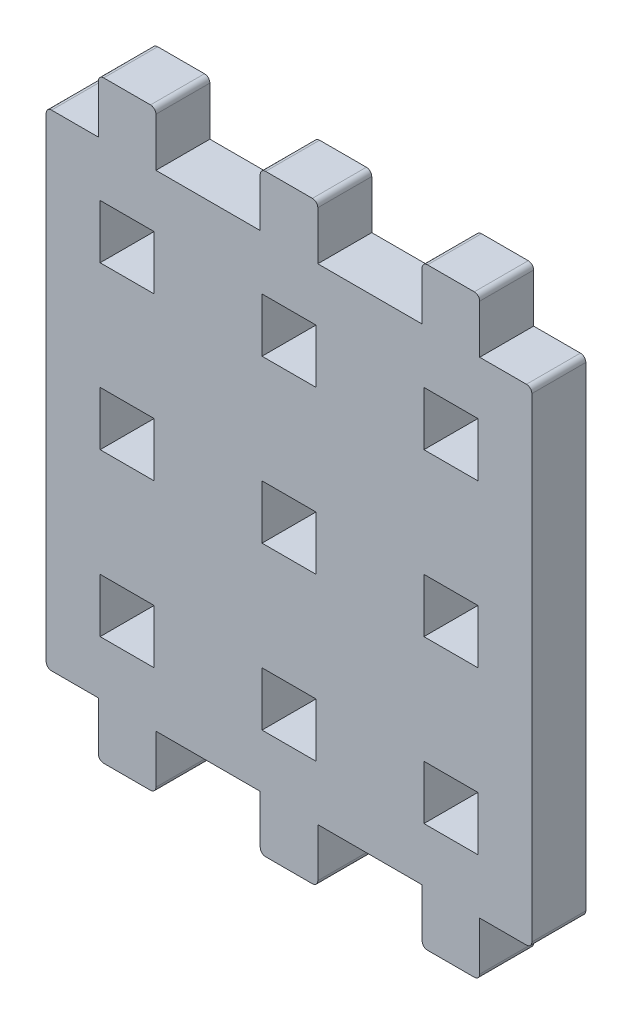
from build123d import *

# Parameters (mm, degrees)
MODEL_W                 = 3
MODEL_H                 = 3
MODEL_W_2               = 3.000000001
SALIENTE_EXTRUIR1_DEPTH = 3


with BuildPart() as part:
    # Model → Saliente-Extruir1 (new body)
    with BuildSketch(Plane.XY):
        with BuildLine():
            Line((8.96548528, 297.776664772), (8.96548528, 271.376664772))
            ThreePointArc((8.96548528, 271.376664772), (9.053353246, 271.164532738), (9.265485281, 271.076664772))
            Line((9.265485281, 271.076664772), (11.86548528, 271.076664772))
            Line((11.86548528, 271.076664772), (11.86548528, 268.376664772))
            ThreePointArc((11.86548528, 268.376664772), (11.953353246, 268.164532738), (12.165485281, 268.076664772))
            Line((12.165485281, 268.076664772), (14.765485281, 268.076664772))
            ThreePointArc((14.765485281, 268.076664772), (14.977617315, 268.164532738), (15.065485281, 268.376664772))
            Line((15.065485281, 268.376664772), (15.065485281, 271.076664772))
            Line((15.065485281, 271.076664772), (20.86548528, 271.076664772))
            Line((20.86548528, 271.076664772), (20.86548528, 268.376664772))
            ThreePointArc((20.86548528, 268.376664772), (20.953353246, 268.164532738), (21.165485281, 268.076664772))
            Line((21.165485281, 268.076664772), (23.76548528, 268.076664772))
            ThreePointArc((23.76548528, 268.076664772), (23.977617315, 268.164532738), (24.06548528, 268.376664772))
            Line((24.06548528, 268.376664772), (24.06548528, 271.076664772))
            Line((24.06548528, 271.076664772), (29.86548528, 271.076664772))
            Line((29.86548528, 271.076664772), (29.86548528, 268.376664772))
            ThreePointArc((29.86548528, 268.376664772), (29.953353246, 268.164532738), (30.165485281, 268.076664772))
            Line((30.165485281, 268.076664772), (32.765485281, 268.076664772))
            ThreePointArc((32.765485281, 268.076664772), (32.977617315, 268.164532738), (33.06548528, 268.376664772))
            Line((33.06548528, 268.376664772), (33.06548528, 271.076664772))
            Line((33.06548528, 271.076664772), (35.66548528, 271.076664772))
            ThreePointArc((35.66548528, 271.076664772), (35.877617315, 271.164532738), (35.96548528, 271.376664772))
            Line((35.96548528, 271.376664772), (35.96548528, 297.776664772))
            ThreePointArc((35.96548528, 297.776664772), (35.877617315, 297.988796806), (35.66548528, 298.076664772))
            Line((35.66548528, 298.076664772), (33.06548528, 298.076664772))
            Line((33.06548528, 298.076664772), (33.06548528, 300.776664772))
            ThreePointArc((33.06548528, 300.776664772), (32.977617315, 300.988796806), (32.765485281, 301.076664772))
            Line((32.765485281, 301.076664772), (30.165485281, 301.076664772))
            ThreePointArc((30.165485281, 301.076664772), (29.953353246, 300.988796806), (29.86548528, 300.776664772))
            Line((29.86548528, 300.776664772), (29.86548528, 298.076664772))
            Line((29.86548528, 298.076664772), (24.06548528, 298.076664772))
            Line((24.06548528, 298.076664772), (24.06548528, 300.776664772))
            ThreePointArc((24.06548528, 300.776664772), (23.977617315, 300.988796806), (23.76548528, 301.076664772))
            Line((23.76548528, 301.076664772), (21.165485281, 301.076664772))
            ThreePointArc((21.165485281, 301.076664772), (20.953353246, 300.988796806), (20.86548528, 300.776664772))
            Line((20.86548528, 300.776664772), (20.86548528, 298.076664772))
            Line((20.86548528, 298.076664772), (15.065485281, 298.076664772))
            Line((15.065485281, 298.076664772), (15.065485281, 300.776664772))
            ThreePointArc((15.065485281, 300.776664772), (14.977617315, 300.988796806), (14.765485281, 301.076664772))
            Line((14.765485281, 301.076664772), (12.165485281, 301.076664772))
            ThreePointArc((12.165485281, 301.076664772), (11.953353246, 300.988796806), (11.86548528, 300.776664772))
            Line((11.86548528, 300.776664772), (11.86548528, 298.076664772))
            Line((11.86548528, 298.076664772), (9.265485281, 298.076664772))
            ThreePointArc((9.265485281, 298.076664772), (9.053353246, 297.988796806), (8.96548528, 297.776664772))
        make_face()
        with Locations((13.46548528, 293.576664772)):
            Rectangle(MODEL_W, MODEL_H, mode=Mode.SUBTRACT)
        with Locations((22.465485281, 293.576664772)):
            Rectangle(MODEL_W_2, MODEL_H, mode=Mode.SUBTRACT)
        with Locations((31.46548528, 293.576664772)):
            Rectangle(MODEL_W, MODEL_H, mode=Mode.SUBTRACT)
        with Locations((13.46548528, 275.576664772)):
            Rectangle(MODEL_W, MODEL_H, mode=Mode.SUBTRACT)
        with Locations((22.465485281, 275.576664772)):
            Rectangle(MODEL_W_2, MODEL_H, mode=Mode.SUBTRACT)
        with Locations((31.46548528, 275.576664772)):
            Rectangle(MODEL_W, MODEL_H, mode=Mode.SUBTRACT)
        with Locations((13.46548528, 284.576664772)):
            Rectangle(MODEL_W, MODEL_H, mode=Mode.SUBTRACT)
        with Locations((22.465485281, 284.576664772)):
            Rectangle(MODEL_W_2, MODEL_H, mode=Mode.SUBTRACT)
        with Locations((31.46548528, 284.576664772)):
            Rectangle(MODEL_W, MODEL_H, mode=Mode.SUBTRACT)
    extrude(amount=SALIENTE_EXTRUIR1_DEPTH)


solid = part.part
